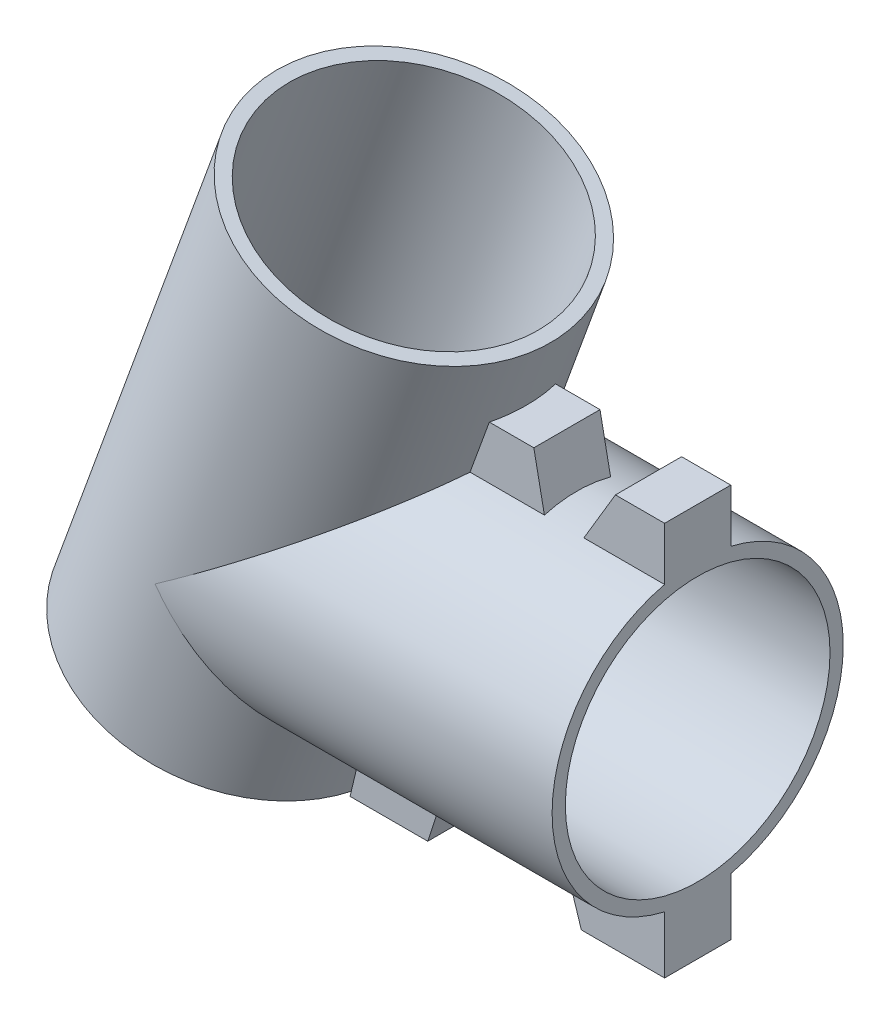
from build123d import *

# Parameters (mm, degrees)
SKETCH_1_R               = 11
SKETCH_1_R_2             = 10
EXTRUDE_1_DEPTH          = 30
EXTRUDE_2_DEPTH          = 25
EXTRUDE_2_DEPTH_BACK     = 12
SKETCH_3_R               = 11
SKETCH_3_R_2             = 10
CUT_EXTRUDE_1_DEPTH      = 47.197717631
CUT_EXTRUDE_1_DEPTH_BACK = 47.197717631
SKETCH_4_R               = 10
EXTRUDE_3_DEPTH          = 2.5


with BuildPart() as part:
    # 草图1 → 凸台-拉伸1 (new body)
    with BuildSketch(Plane(origin=(0, 0, 0), x_dir=(0, 0, -1), z_dir=(1, 0, 0))):
        Circle(SKETCH_1_R)
        Circle(SKETCH_1_R_2, mode=Mode.SUBTRACT)
    extrude(amount=EXTRUDE_1_DEPTH)

    # 草图3 → 凸台-拉伸2 (add, two sides: drawn at the far end of the back side and taken through both)
    with BuildSketch(Plane(origin=(0, 0, 0), x_dir=(0, 0, 1), z_dir=(0.34202014332566616, 0.9396926207859094, 0)).offset(-EXTRUDE_2_DEPTH_BACK)):
        with Locations(Location((0, 0, 0), (0, 0, 270))):
            Circle(SKETCH_3_R)
        with Locations(Location((0, 0, 0), (0, 0, 270))):
            Circle(SKETCH_3_R_2, mode=Mode.SUBTRACT)
    extrude(amount=EXTRUDE_2_DEPTH + EXTRUDE_2_DEPTH_BACK)

    # 草图4 → 切除-拉伸1 (cut, two sides: drawn at the far end of the back side and taken through both)
    with BuildSketch(Plane(origin=(8.550503583, 23.49231552, 0), x_dir=(0.9396926207859094, -0.34202014332566616, 0), z_dir=(0.34202014332566616, 0.9396926207859094, 0)).offset(-CUT_EXTRUDE_1_DEPTH_BACK)):
        with Locations(Location((0, 0, 0), (0, 0, 180))):
            Circle(SKETCH_4_R)
    extrude(amount=CUT_EXTRUDE_1_DEPTH + CUT_EXTRUDE_1_DEPTH_BACK, mode=Mode.SUBTRACT)

    # 草图5 → 凸台-拉伸3 (add, symmetric)
    with BuildSketch(Plane.XY):
        Polygon((30, -15.038533026), (30, -10.465206376), (7.327816394, -10.465206376), (6.232377109, -15.038533026), (12.104215946, -15.038533026), (13.563766866, -10.544718828), (22.267951213, -10.544718828), (23.709783725, -15.038533026), align=None)
        Polygon((30, 14.71794675), (26.28445499, 14.71794675), (23.829223727, 10.593233767), (20.943088353, 10.593233767), (20.119656379, 14.71794675), (16.333874379, 14.71794675), (14.620931943, 10.237686762), (30, 10.237686762), align=None)
    extrude(amount=EXTRUDE_3_DEPTH, both=True)


solid = part.part
